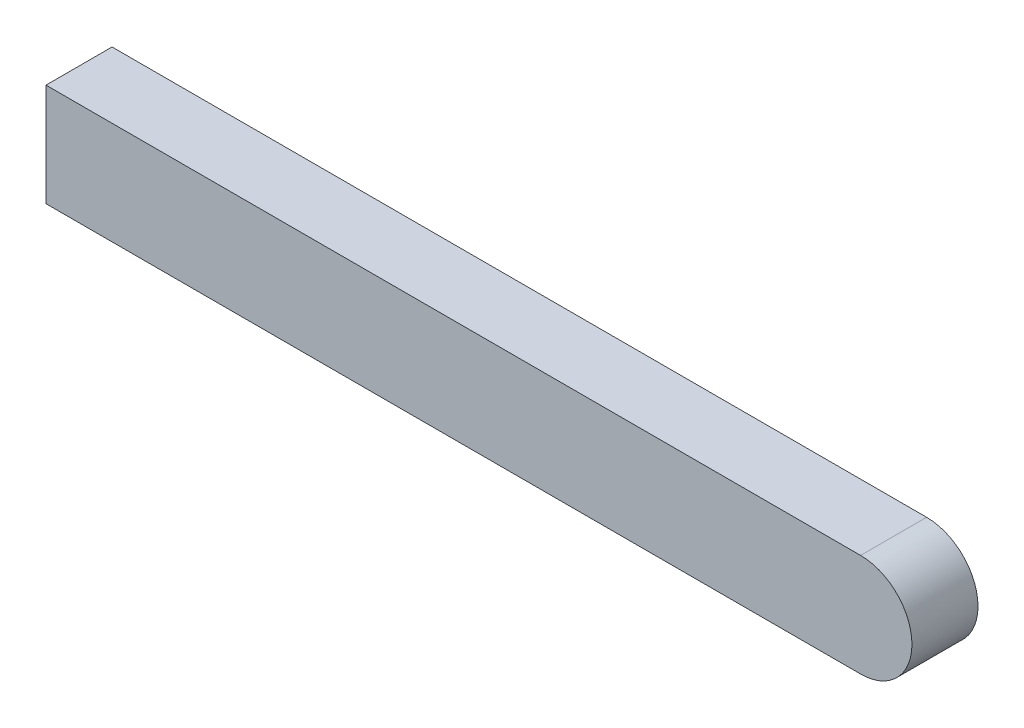
from build123d import *

# Parameters (mm, degrees)
BOSS_EXTRUDE1_DEPTH = 9
SKETCH2_W           = 21.252561517
SKETCH2_H           = 15.842942766
CUT_EXTRUDE1_DEPTH  = 10


with BuildPart() as part:
    # Sketch1 → Boss-Extrude1 (new body)
    with BuildSketch(Plane.XY):
        with BuildLine():
            Line((-55.5, 7), (55.5, 7))
            ThreePointArc((55.5, 7), (62.5, 0), (55.5, -7))
            Line((55.5, -7), (-55.5, -7))
            ThreePointArc((-55.5, -7), (-62.5, 0), (-55.5, 7))
        make_face()
    extrude(amount=BOSS_EXTRUDE1_DEPTH)

    # Sketch2 → Cut-Extrude1 (cut)
    with BuildSketch(Plane.XY.offset(9)):
        with Locations((-66.126280759, -0.921471383)):
            Rectangle(SKETCH2_W, SKETCH2_H)
    extrude(amount=-CUT_EXTRUDE1_DEPTH, mode=Mode.SUBTRACT)


solid = part.part
